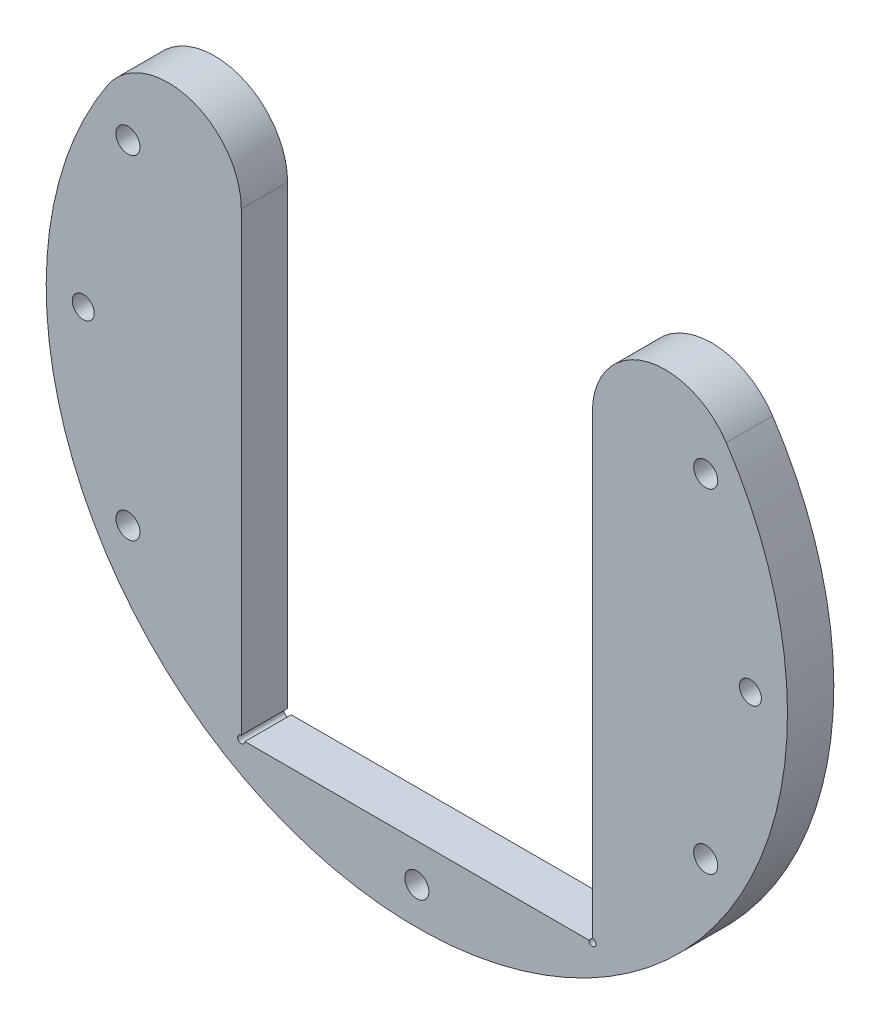
from build123d import *

# Parameters (mm, degrees)
SKETCH1_R           = 1.5
SKETCH1_R_2         = 1.65
BOSS_EXTRUDE1_DEPTH = 6.35
FILLET2_R           = 10
SKETCH2_R           = 0.5
CUT_EXTRUDE1_DEPTH  = 73.122135992


with BuildPart() as part:
    # Sketch1 → Boss-Extrude1 (new body)
    with BuildSketch(Plane.XY):
        with BuildLine():
            Line((24.062500008, -40.5), (24.062500008, 40.5))
            Line((24.062500008, 40.5), (24.062500008, 44.73964789))
            ThreePointArc((24.062500008, 44.73964789), (0, -50.8), (-24.062500008, 44.73964789))
            Line((-24.062500008, 44.73964789), (-24.062500008, 40.5))
            Line((-24.062500008, 40.5), (-24.062500008, -40.5))
            Line((-24.062500008, -40.5), (24.062500008, -40.5))
        make_face()
        with Locations((-45.72, 0)):
            Circle(SKETCH1_R, mode=Mode.SUBTRACT)
        with Locations((45.72, 0)):
            Circle(SKETCH1_R, mode=Mode.SUBTRACT)
        with Locations((-39.594681461, 22.86)):
            Circle(SKETCH1_R_2, mode=Mode.SUBTRACT)
        with Locations((39.594681461, 22.86)):
            Circle(SKETCH1_R_2, mode=Mode.SUBTRACT)
        with Locations((39.594681461, -22.86)):
            Circle(SKETCH1_R_2, mode=Mode.SUBTRACT)
        with Locations((0, -45.72)):
            Circle(SKETCH1_R_2, mode=Mode.SUBTRACT)
        with Locations((-39.594681461, -22.86)):
            Circle(SKETCH1_R_2, mode=Mode.SUBTRACT)
    extrude(amount=BOSS_EXTRUDE1_DEPTH)

    # Fillet2
    fillet2_edges = [part.edges().sort_by_distance(p)[0] for p in [
        (24.062500008, 44.73964789, 3.175),
        (-24.062500008, 44.73964789, 3.175),
    ]]
    fillet(fillet2_edges, radius=FILLET2_R)

    # Sketch2 → Cut-Extrude1 (cut, through all)
    with BuildSketch(Plane.XY.offset(6.35)):
        with Locations((-24.062500008, -40.5)):
            Circle(SKETCH2_R)
        with Locations((24.062500008, -40.5)):
            Circle(SKETCH2_R)
    extrude(amount=-CUT_EXTRUDE1_DEPTH, mode=Mode.SUBTRACT)


solid = part.part
